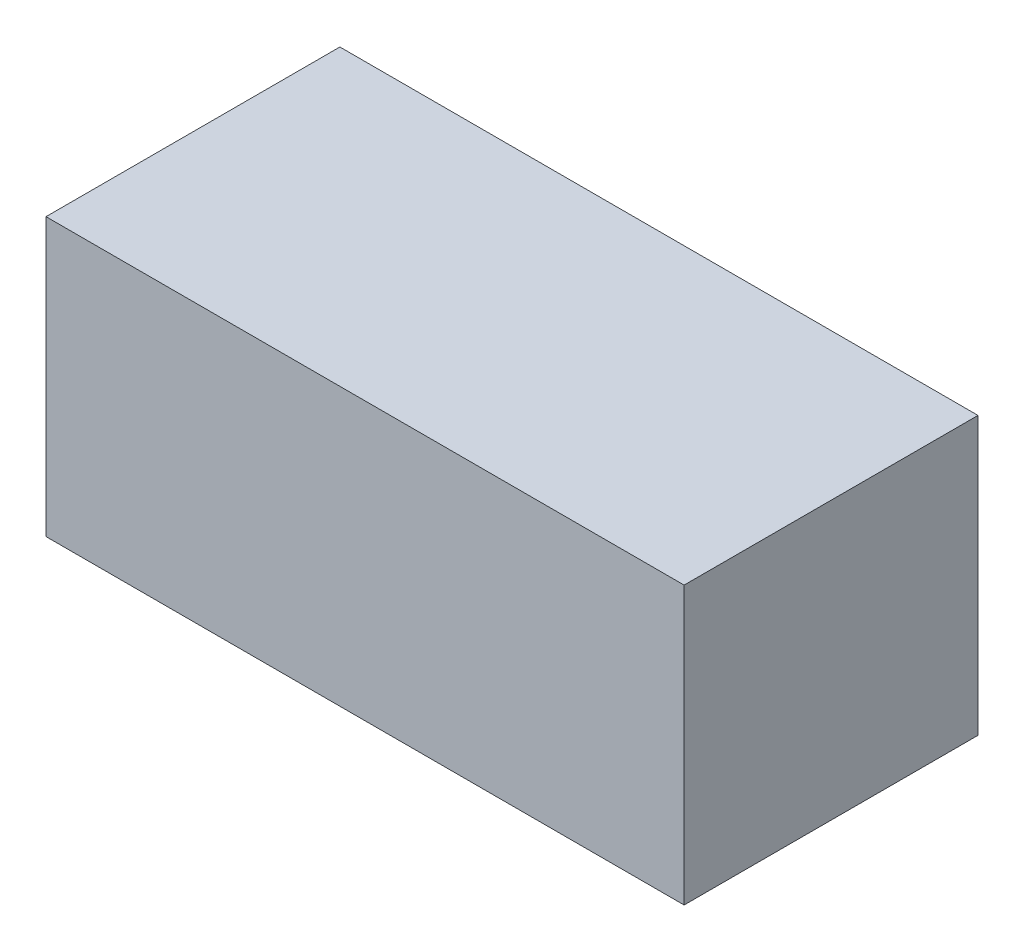
from build123d import *

# Parameters (mm, degrees)
SKETCH1_W           = 76
SKETCH1_H           = 35
BOSS_EXTRUDE1_DEPTH = 33


with BuildPart() as part:
    # Sketch1 → Boss-Extrude1 (new body)
    with BuildSketch(Plane(origin=(0, 0, 0), x_dir=(1, 0, 0), z_dir=(0, 1, 0))):
        Rectangle(SKETCH1_W, SKETCH1_H)
    extrude(amount=BOSS_EXTRUDE1_DEPTH)


solid = part.part
